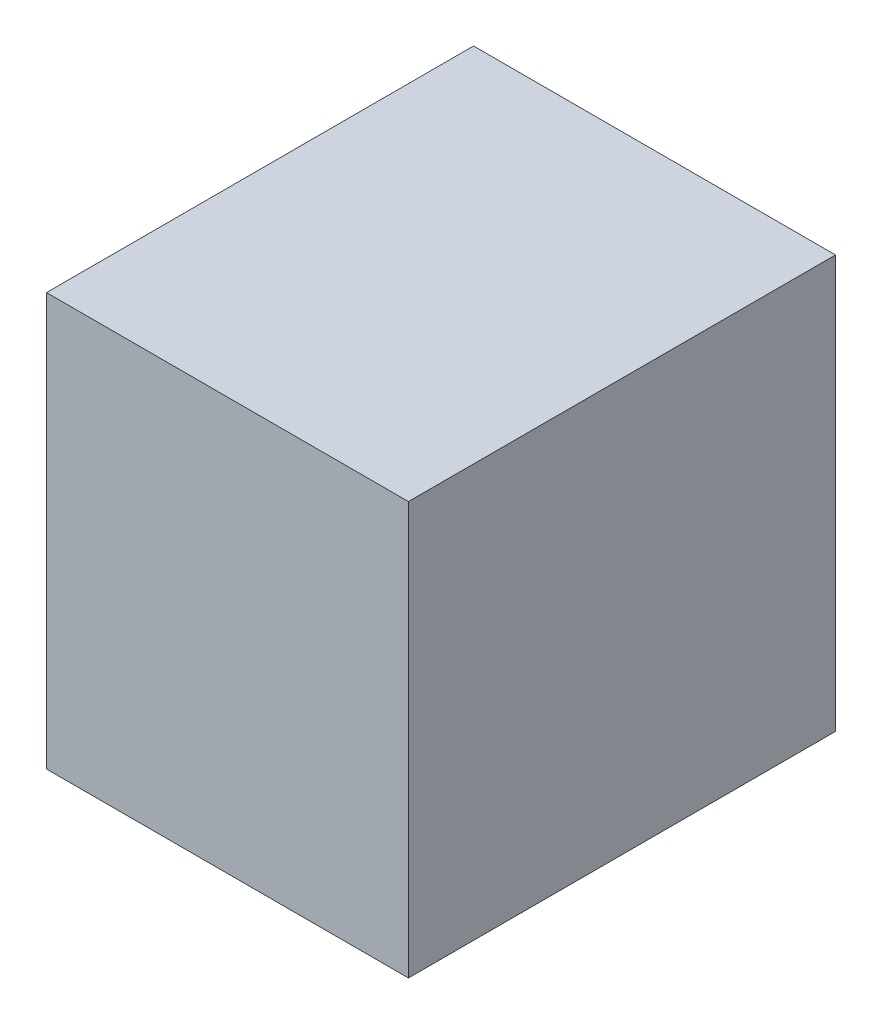
from build123d import *

# Parameters (mm, degrees)
SKETCH_1_W      = 500
SKETCH_1_H      = 570
EXTRUDE_1_DEPTH = 590


with BuildPart() as part:
    # 草圖1 → 填料-伸長1 (new body)
    with BuildSketch(Plane.XY):
        with Locations((-56.972789116, -26.341991342)):
            Rectangle(SKETCH_1_W, SKETCH_1_H)
    extrude(amount=EXTRUDE_1_DEPTH)


solid = part.part
